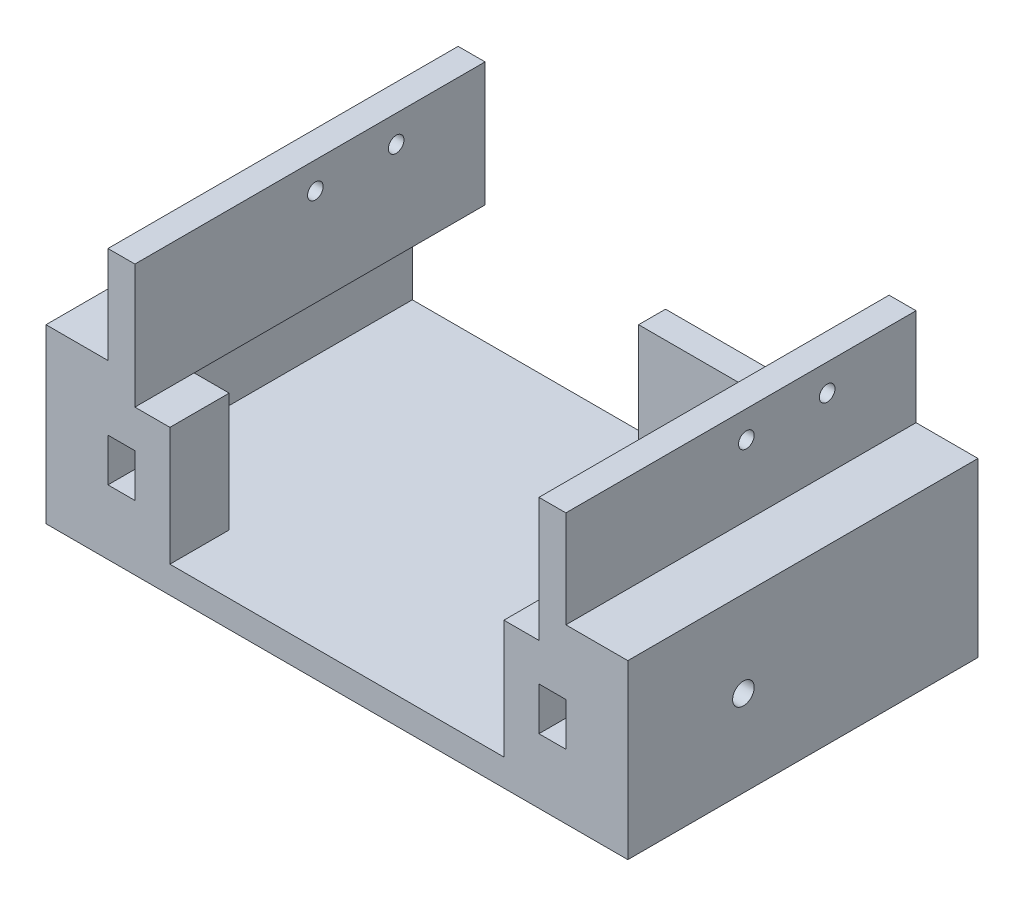
from build123d import *

# Parameters (mm, degrees)
EXTRUDE_1_DEPTH          = 65
SKETCH_3_R               = 2
CUT_EXTRUDE_2_DEPTH      = 136.321005452
SKETCH_4_W               = 30
SKETCH_4_H               = 22
EXTRUDE_2_DEPTH          = 5
CUT_EXTRUDE_4_DEPTH      = 123.556209621
CUT_EXTRUDE_4_DEPTH_BACK = 123.556209621
SKETCH_9_R               = 1.45
SKETCH_10_W              = 20
SKETCH_10_H              = 22
SKETCH_10_W_2            = 5
SKETCH_10_H_2            = 8
EXTRUDE_6_DEPTH          = 11


with BuildPart() as part:
    # 草圖1 → 填料-伸長1 (new body)
    with BuildSketch(Plane.XY):
        Polygon((-26.364407373, 0.778312538), (-21.364407373, 0.778312538), (-21.364407373, -22.221687462), (-34.864407373, -22.221687462), (-34.864407373, -44.221687462), (67.135592627, -44.221687462), (67.135592627, -22.221687462), (53.635592627, -22.221687462), (53.635592627, 0.778312538), (58.635592627, 0.778312538), (58.635592627, -17.221687462), (70.135592627, -17.221687462), (70.135592627, -49.221687462), (-37.864407373, -49.221687462), (-37.864407373, -17.221687462), (-26.364407373, -17.221687462), align=None)
    extrude(amount=EXTRUDE_1_DEPTH)

    # 草圖3 → 除料-伸長2 (cut, through all)
    with BuildSketch(Plane.ZY.offset(37.864407373)):
        with Locations((43.545745688, -33.221687462)):
            Circle(SKETCH_3_R)
    extrude(amount=-CUT_EXTRUDE_2_DEPTH, mode=Mode.SUBTRACT)

    # 草圖4 → 填料-伸長2 (add)
    with BuildSketch(Plane(origin=(0, 0, 0), x_dir=(-1, 0, 0), z_dir=(0, 0, -1))):
        with Locations((-27.135592627, -33.221687462)):
            Rectangle(SKETCH_4_W, SKETCH_4_H)
    extrude(amount=-EXTRUDE_2_DEPTH)

    # 草圖9 → 除料-伸長4 (cut, two sides: drawn at the far end of the back side and taken through both)
    with BuildSketch(Plane(origin=(-21.364407373, 0, 0), x_dir=(0, 0, -1), z_dir=(1, 0, 0)).offset(-CUT_EXTRUDE_4_DEPTH_BACK)):
        with Locations(Location((-31.5, -4.221687462, 0), (0, 0, 90))):
            Circle(SKETCH_9_R)
        with Locations(Location((-16.5, -4.221687462, 0), (0, 0, 90))):
            Circle(SKETCH_9_R)
    extrude(amount=CUT_EXTRUDE_4_DEPTH + CUT_EXTRUDE_4_DEPTH_BACK, mode=Mode.SUBTRACT)

    # 草圖10 → 填料-伸長6 (add)
    # profile 1 of 2: a face of its own
    with BuildSketch(Plane.XY.offset(65)):
        with Locations((-24.864407373, -33.221687462)):
            Rectangle(SKETCH_10_W, SKETCH_10_H)
        with Locations((-23.864407373, -33.221687462)):
            Rectangle(SKETCH_10_W_2, SKETCH_10_H_2, mode=Mode.SUBTRACT)
    # profile 2 of 2: a face of its own
    with BuildSketch(Plane.XY.offset(65)):
        with Locations((57.135592627, -33.221687462)):
            Rectangle(SKETCH_10_W, SKETCH_10_H)
        with Locations((56.135592627, -33.221687462)):
            Rectangle(SKETCH_10_W_2, SKETCH_10_H_2, mode=Mode.SUBTRACT)
    extrude(amount=-EXTRUDE_6_DEPTH)


solid = part.part
